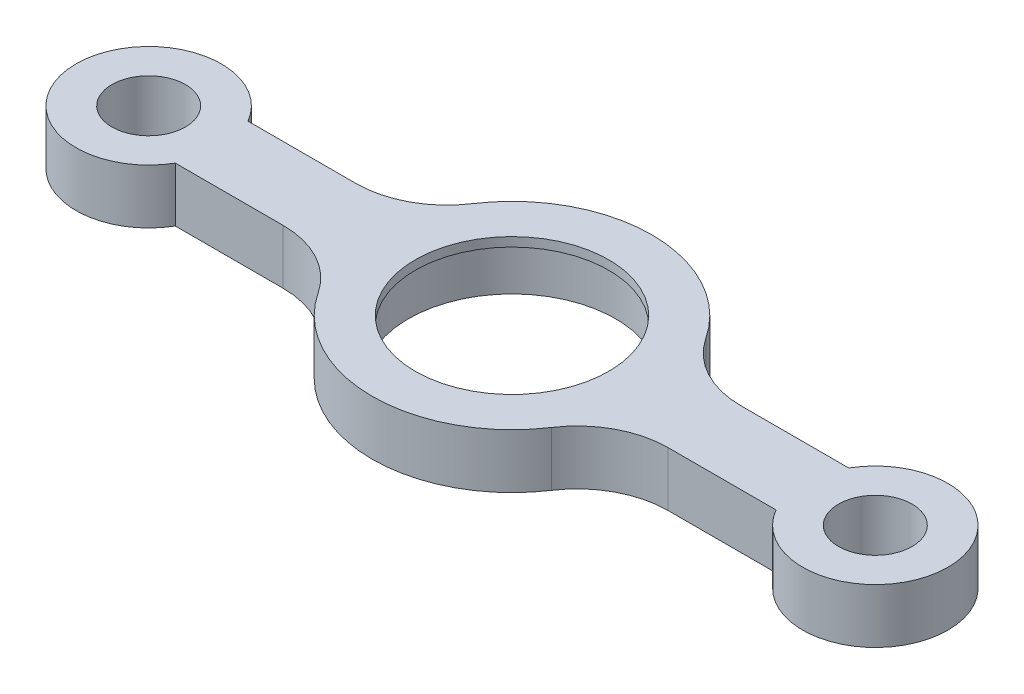
from build123d import *

# Parameters (mm, degrees)
ESBO_O1_R                = 4.05
ESBO_O1_R_2              = 11.4
RESSALTO_EXTRUS_O1_DEPTH = 6
RESSALTO_EXTRUS_O2_START = -1
ESBO_O2_R                = 11.4
ESBO_O2_R_2              = 10.65
RESSALTO_EXTRUS_O2_DEPTH = 1


with BuildPart() as part:
    # Esboço1 → Ressalto-extrusão1 (new body)
    with BuildSketch(Plane(origin=(0, 0, 0), x_dir=(1, 0, 0), z_dir=(0, 1, 0))):
        with BuildLine():
            Line((-33.07179677, 4), (-21.193395198, 4))
            ThreePointArc((-21.193395198, 4), (-16.456207753, 5.193238103), (-12.849538821, 8.488188976))
            ThreePointArc((-12.849538821, 8.488188976), (0, 15.4), (12.849538821, 8.488188976))
            ThreePointArc((12.849538821, 8.488188976), (16.456207753, 5.193238103), (21.193395198, 4))
            Line((21.193395198, 4), (33.07179677, 4))
            ThreePointArc((33.07179677, 4), (48, 0), (33.07179677, -4))
            Line((33.07179677, -4), (21.193395198, -4))
            ThreePointArc((21.193395198, -4), (16.456207753, -5.193238103), (12.849538821, -8.488188976))
            ThreePointArc((12.849538821, -8.488188976), (0, -15.4), (-12.849538821, -8.488188976))
            ThreePointArc((-12.849538821, -8.488188976), (-16.456207753, -5.193238103), (-21.193395198, -4))
            Line((-21.193395198, -4), (-33.07179677, -4))
            ThreePointArc((-33.07179677, -4), (-48, 0), (-33.07179677, 4))
        make_face()
        with Locations(Location((40, 0, 0), (0, 0, 270))):
            Circle(ESBO_O1_R, mode=Mode.SUBTRACT)
        with Locations(Location((-40, 0, 0), (0, 0, 270))):
            Circle(ESBO_O1_R, mode=Mode.SUBTRACT)
        with Locations(Location((0, 0, 0), (0, 0, 270))):
            Circle(ESBO_O1_R_2, mode=Mode.SUBTRACT)
    extrude(amount=RESSALTO_EXTRUS_O1_DEPTH)

    # Esboço2 → Ressalto-extrusão2 (add)
    with BuildSketch(Plane(origin=(0, 6, 0), x_dir=(1, 0, 0), z_dir=(0, 1, 0)).offset(RESSALTO_EXTRUS_O2_START)):
        with Locations(Location((0, 0, 0), (0, 0, 270))):
            Circle(ESBO_O2_R)
        with Locations(Location((0, 0, 0), (0, 0, 270))):
            Circle(ESBO_O2_R_2, mode=Mode.SUBTRACT)
    extrude(amount=RESSALTO_EXTRUS_O2_DEPTH)


solid = part.part
